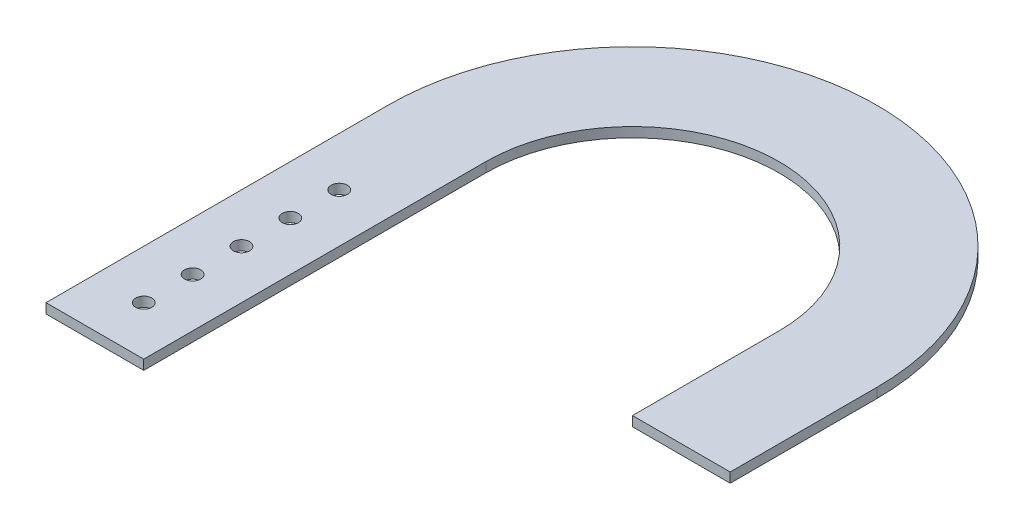
from build123d import *

# Parameters (mm, degrees)
BOSS_EXTRUDE1_DEPTH = 2.54
SKETCH2_R           = 2.0955
CUT_EXTRUDE1_DEPTH  = 110.279053803


with BuildPart() as part:
    # Sketch1 → Boss-Extrude1 (new body)
    with BuildSketch(Plane(origin=(0, 0, 0), x_dir=(1, 0, 0), z_dir=(0, 1, 0))):
        with BuildLine():
            Line((-38.1, -88.9), (-38.1, 0))
            ThreePointArc((-38.1, 0), (0, 38.1), (38.1, 0))
            Line((38.1, 0), (38.1, -38.1))
            Line((38.1, -38.1), (63.5, -38.1))
            Line((63.5, -38.1), (63.5, 0))
            ThreePointArc((63.5, 0), (0, 63.5), (-63.5, 0))
            Line((-63.5, 0), (-63.5, -88.9))
            Line((-63.5, -88.9), (-38.1, -88.9))
        make_face()
    extrude(amount=BOSS_EXTRUDE1_DEPTH)

    # Sketch2 → Cut-Extrude1 (cut, through all)
    with BuildSketch(Plane(origin=(0, 2.54, 0), x_dir=(1, 0, 0), z_dir=(0, 1, 0))):
        with Locations(Location((-50.8, -76.2, 0), (0, 0, 270))):
            Circle(SKETCH2_R)
        with Locations(Location((-50.8, -63.5, 0), (0, 0, 270))):
            Circle(SKETCH2_R)
        with Locations(Location((-50.8, -50.8, 0), (0, 0, 270))):
            Circle(SKETCH2_R)
        with Locations(Location((-50.8, -38.1, 0), (0, 0, 270))):
            Circle(SKETCH2_R)
        with Locations(Location((-50.8, -25.4, 0), (0, 0, 270))):
            Circle(SKETCH2_R)
    extrude(amount=-CUT_EXTRUDE1_DEPTH, mode=Mode.SUBTRACT)


solid = part.part
